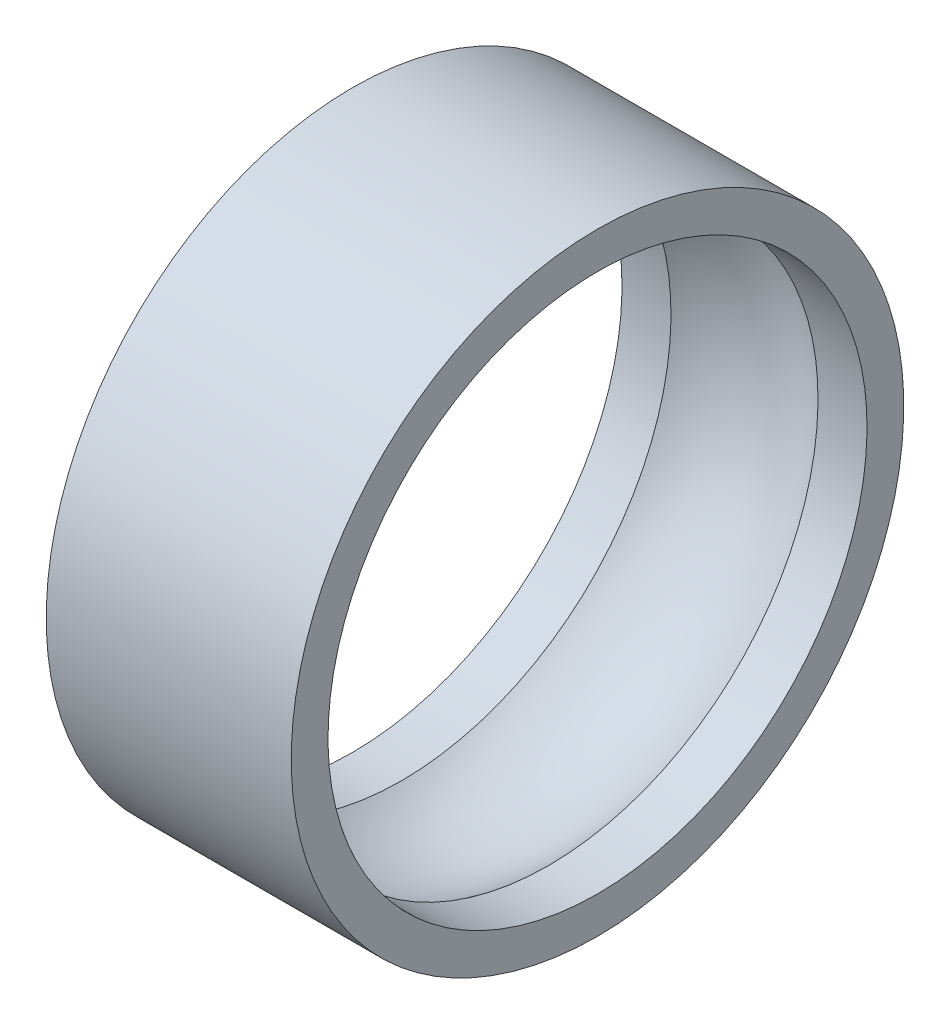
from build123d import *


with BuildPart() as part:
    # Sketch2 → Revolve1 (revolve)
    with BuildSketch(Plane.XY, mode=Mode.PRIVATE) as revolve1_sk:
        with BuildLine():
            Line((10, 25), (-10, 25))
            Line((-10, 25), (-10, 22))
            Line((-10, 22), (-6, 22))
            ThreePointArc((-6, 22), (0, 24), (6, 22))
            Line((6, 22), (10, 22))
            Line((10, 22), (10, 25))
        make_face()
    revolve(revolve1_sk.sketch.rotate(Axis((-10, 0, 0), (1, 0, 0)), 180), axis=Axis((-10, 0, 0), (1, 0, 0)))


solid = part.part
